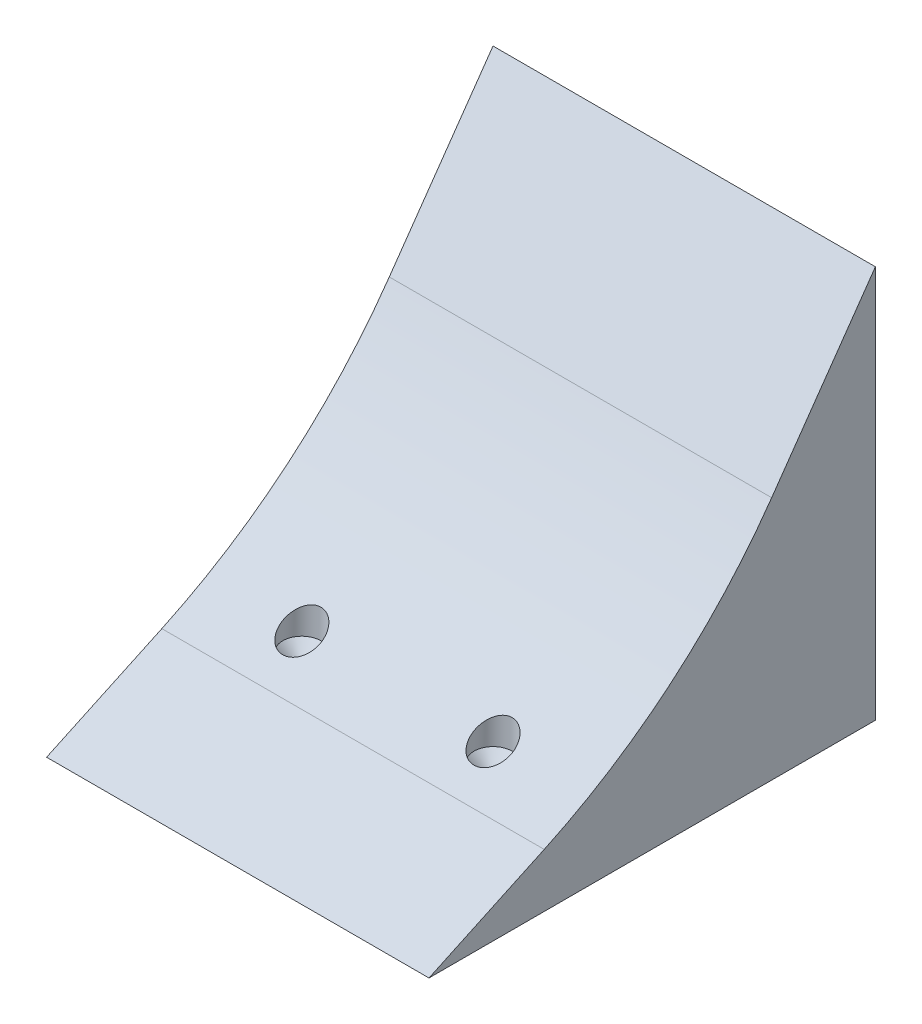
from build123d import *

# Parameters (mm, degrees)
BOSS_EXTRUDE1_DEPTH = 101.6
SKETCH2_R           = 1.905
CUT_EXTRUDE1_DEPTH  = 101.6
CUT_EXTRUDE2_START  = -12.7
SKETCH3_R           = 5.08
CUT_EXTRUDE2_DEPTH  = 101.6
CHAMFER1_SIZE       = 3.048


with BuildPart() as part:
    # Sketch1 → Boss-Extrude1 (new body)
    with BuildSketch(Plane(origin=(0, 0, 0), x_dir=(0, 0, -1), z_dir=(1, 0, 0))):
        with BuildLine():
            Line((-61.489643294, -124.315200567), (57.124090119, -124.315200567))
            Line((57.124090119, -124.315200567), (57.124090119, -19.966735992))
            Line((57.124090119, -19.966735992), (29.562861669, -59.328249467))
            ThreePointArc((29.562861669, -59.328249467), (2.684921835, -88.660373698), (-30.868886791, -110.036507311))
            Line((-30.868886791, -110.036507311), (-61.489643294, -124.315200567))
        make_face()
    extrude(amount=BOSS_EXTRUDE1_DEPTH)

    # Sketch2 → Cut-Extrude1 (cut)
    with BuildSketch(Plane.XZ.offset(124.315200567)):
        with Locations(Location((25.4, 19.075909881, 0), (0, 0, 270))):
            Circle(SKETCH2_R)
        with Locations(Location((76.2, 19.075909881, 0), (0, 0, 270))):
            Circle(SKETCH2_R)
    extrude(amount=-CUT_EXTRUDE1_DEPTH, mode=Mode.SUBTRACT)

    # Sketch3 → Cut-Extrude2 (cut)
    with BuildSketch(Plane.XZ.offset(124.315200567).offset(CUT_EXTRUDE2_START)):
        with Locations(Location((25.4, 19.075909881, 0), (0, 0, 270))):
            Circle(SKETCH3_R)
        with Locations(Location((76.2, 19.075909881, 0), (0, 0, 270))):
            Circle(SKETCH3_R)
    extrude(amount=-CUT_EXTRUDE2_DEPTH, mode=Mode.SUBTRACT)

    # Chamfer1
    chamfer1_edges = [part.edges().sort_by_distance(p)[0] for p in [
        (25.4, -111.615200567, 24.155909881),
        (76.2, -111.615200567, 24.155909881),
    ]]
    chamfer(chamfer1_edges, length=CHAMFER1_SIZE)


solid = part.part
